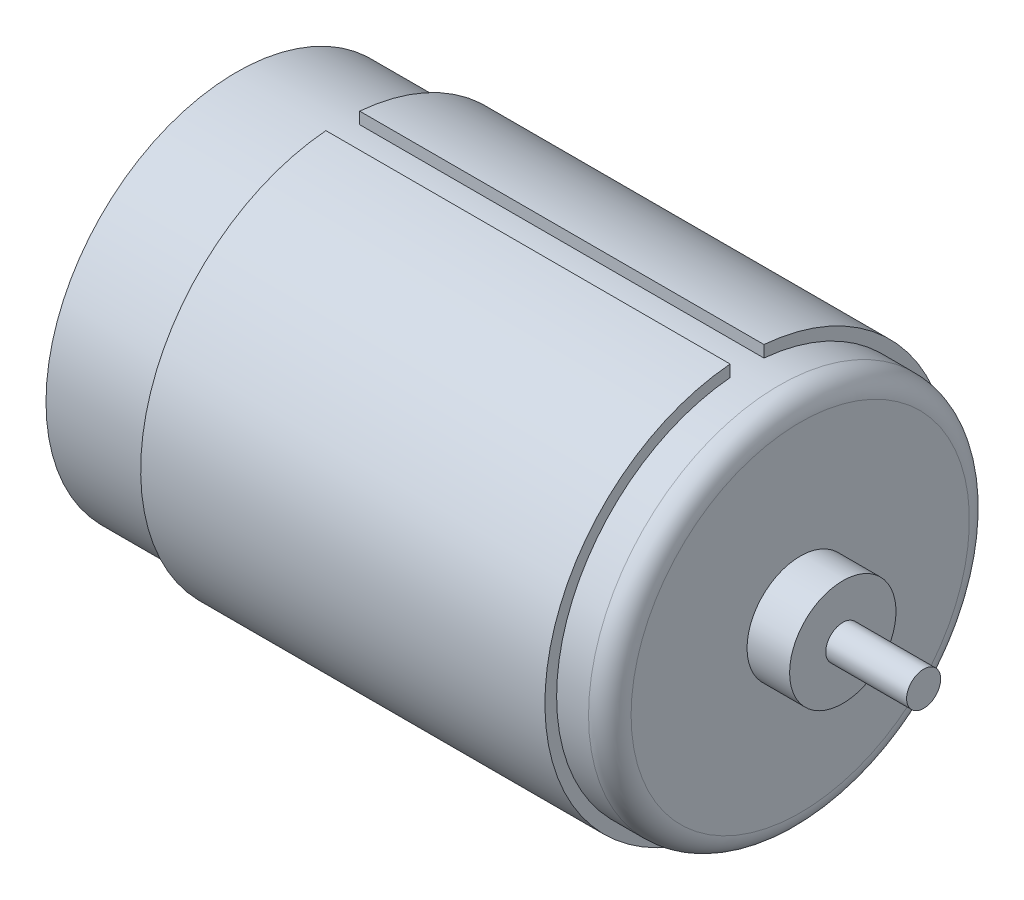
from build123d import *

# Parameters (mm, degrees)
CUT_EXTRUDE1_REACH = 62.854


with BuildPart() as part:
    # Sketch3 → Revolve1 (revolve)
    with BuildSketch(Plane.XY, mode=Mode.PRIVATE) as revolve1_sk:
        with BuildLine():
            Line((0, 0), (0, 17.9))
            Line((0, 17.9), (10, 17.9))
            Line((10, 17.9), (10, 19))
            Line((10, 19), (48, 19))
            Line((48, 19), (48, 17.9))
            Line((48, 17.9), (51, 17.9))
            ThreePointArc((51, 17.9), (52.414213562, 17.314213562), (53, 15.9))
            Line((53, 15.9), (53, 5))
            Line((53, 5), (57, 5))
            Line((57, 5), (57, 1.6))
            Line((57, 1.6), (64.6, 1.6))
            Line((64.6, 1.6), (64.6, 0))
            Line((64.6, 0), (49.67547572, 0))
            Line((49.67547572, 0), (49.67547572, 14.901654032))
            Line((49.67547572, 14.901654032), (4.301788407, 14.901654032))
            Line((4.301788407, 14.901654032), (4.301788407, 0))
            Line((4.301788407, 0), (0, 0))
        make_face()
    revolve(revolve1_sk.sketch.rotate(Axis((0, 0, 0), (1, 0, 0)), 90), axis=Axis((0, 0, 0), (1, 0, 0)))

    # Sketch4 → Cut-Extrude1 (cut, up to next)
    with BuildSketch(Plane.ZY.offset(-10), mode=Mode.PRIVATE) as cut_extrude1_sk1:
        with BuildLine():
            Line((1.5875, 18.933563947), (1.5875, 17.829465605))
            ThreePointArc((1.5875, 17.829465605), (0, 17.9), (-1.5875, 17.829465605))
            Line((-1.5875, 17.829465605), (-1.5875, 18.933563947))
            ThreePointArc((-1.5875, 18.933563947), (0, 19), (1.5875, 18.933563947))
        make_face()
    cut_extrude1_tool1 = extrude(cut_extrude1_sk1.sketch, amount=-CUT_EXTRUDE1_REACH, mode=Mode.PRIVATE) & part.part
    add(cut_extrude1_tool1.solids().sort_by_distance((10, 18.427166, 0))[0], mode=Mode.SUBTRACT)


solid = part.part
